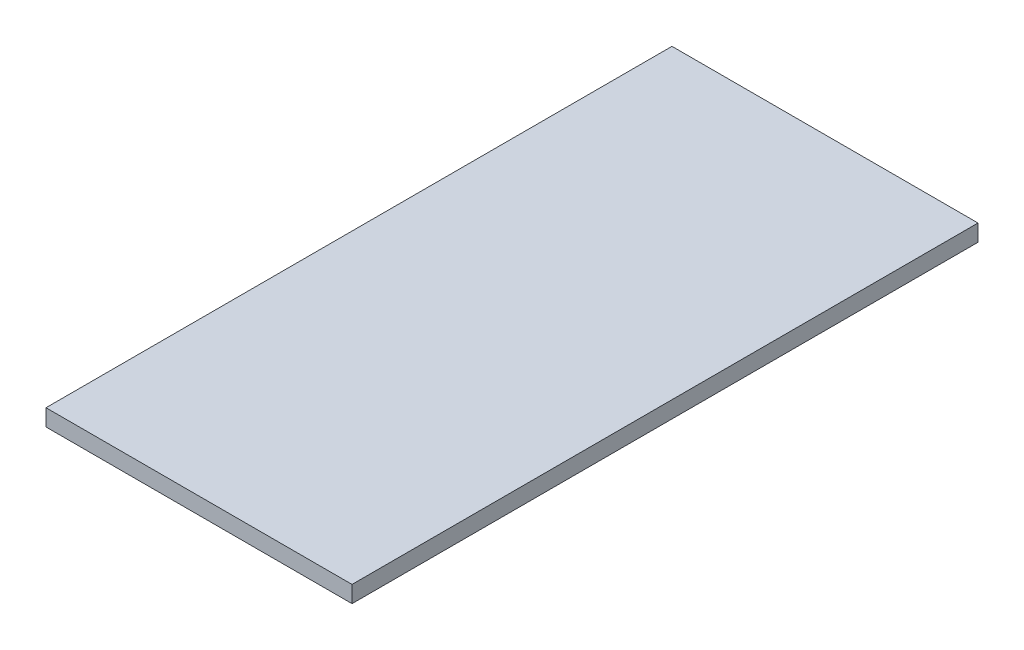
from build123d import *

# Parameters (mm, degrees)
SKETCH1_W           = 22
SKETCH1_H           = 45
BOSS_EXTRUDE1_DEPTH = 1.2


with BuildPart() as part:
    # Sketch1 → Boss-Extrude1 (new body)
    with BuildSketch(Plane(origin=(0, 0, 0), x_dir=(1, 0, 0), z_dir=(0, 1, 0))):
        Rectangle(SKETCH1_W, SKETCH1_H)
    extrude(amount=BOSS_EXTRUDE1_DEPTH)


solid = part.part
